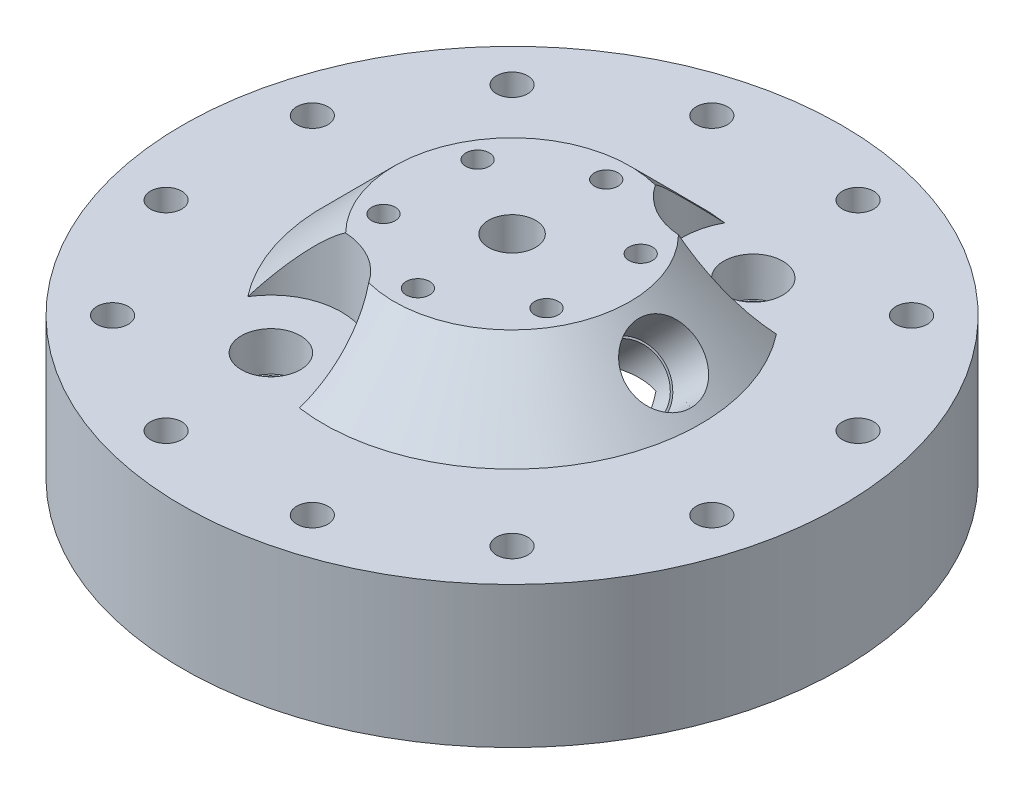
from build123d import *

# Parameters (mm, degrees)
F_5_16_CLEARANCE_HOLE1_D         = 8.4328
CIRPATTERN1_COUNT                = 12
F_1_2_0_5_DIAMETER_HOLE1_D       = 12.7
F_1_1_5_DIAMETER_HOLE1_D         = 38.1
F_1_1_5_DIAMETER_HOLE1_DEPTH     = 19.05
CIRPATTERN2_COUNT                = 6
CIRPATTERN3_COUNT                = 2
F_1_8_0_125_DIAMETER_HOLE1_D     = 3.175
F_1_8_0_125_DIAMETER_HOLE1_DEPTH = 6.35
F_1_8_0_125_DIAMETER_HOLE1_TIP   = 0.953866233


with BuildPart() as part:
    # Sketch1 → Revolve1 (revolve)
    with BuildSketch(Plane.XY, mode=Mode.PRIVATE) as revolve1_sk:
        Polygon((-55.9435, 0), (-88.9, 0), (-88.9, 38.1), (-50.8, 38.1), (-31.75, 57.15), (0, 57.15), (0, 31.75), (-31.75, 31.75), (-31.75, 19.05), (-50.8, 19.05), (-50.8, 0), (-52.3875, 0), (-52.3875, 2.54), (-55.9435, 2.54), align=None)
    revolve(revolve1_sk.sketch.rotate(Axis((0, 0, 0), (0, 1, 0)), 270), axis=Axis((0, 0, 0), (0, 1, 0)))

    # 5/16 Clearance Hole1 (through all)
    with Locations(Plane(origin=(0, 38.1, 0), x_dir=(1, 0, 0), z_dir=(0, 1, 0))):
        with Locations((-73.603547963, -19.722011237)):
            f_5_16_clearance_hole1 = Hole(F_5_16_CLEARANCE_HOLE1_D / 2)

    # CirPattern1: 5/16 Clearance Hole1 ×12 about axis
    cirpattern1_axis = Axis((0, 0, 0), (0, 1, 0))
    for i in range(1, CIRPATTERN1_COUNT):
        add(f_5_16_clearance_hole1.rotate(cirpattern1_axis, i * 360 / CIRPATTERN1_COUNT), mode=Mode.SUBTRACT)

    # 1/2 (0.5) Diameter Hole1 (through all)
    with Locations(Plane(origin=(0, 57.15, 0), x_dir=(1, 0, 0), z_dir=(0, 1, 0))):
        with Locations((0, 0)):
            Hole(F_1_2_0_5_DIAMETER_HOLE1_D / 2)

    # Sketch11 → 1/2 NPT Tapped Hole1 (revolve, cut)
    with BuildSketch(Plane(origin=(41.275, 47.625, 0), x_dir=(-0.707106781186546, 0.707106781186549, 0), z_dir=(0, 0, 1))):
        Polygon((0, 0), (0, 125.723585695), (8.9281, 125.723585695), (8.9281, 13.462), (9.479726792, 13.462), (9.8827971, 0), align=None)
    revolve(axis=Axis((45.765128061, 52.115128061, 0), (-0.707106781186549, -0.707106781186546, 0)), mode=Mode.SUBTRACT)

    # 1 (1.5) Diameter Hole1
    with Locations(Plane(origin=(0, 57.15, 0), x_dir=(1, 0, 0), z_dir=(0, 1, 0))):
        with Locations((-23.8125, -41.244459855)):
            f_1_1_5_diameter_hole1 = Hole(F_1_1_5_DIAMETER_HOLE1_D / 2, depth=F_1_1_5_DIAMETER_HOLE1_DEPTH)

    # Sketch19 → 3/8 NPT Tapped Hole1 (revolve, cut)
    with BuildSketch(Plane(origin=(-23.8125, 38.1, 41.244459855), x_dir=(0, 0, 1), z_dir=(1, 0, 0))):
        Polygon((0, 0), (0, 26.640582582), (7.1374, 22.352), (7.1374, 10.414), (7.653732494, 10.414), (7.9655416, 0), align=None)
    f_3_8_npt_tapped_hole1 = revolve(axis=Axis((-23.8125, 44.45, 41.244459855), (0, -1, 0)), mode=Mode.SUBTRACT)

    # Sketch21 → 1/4 (0.25) Diameter Hole1 (revolve, cut)
    with BuildSketch(Plane(origin=(21.997045256, 57.15, -12.7), x_dir=(0, 0, 1), z_dir=(1, 0, 0))):
        Polygon((0, 0), (0, 17.782732465), (3.175, 15.875), (3.175, 0), align=None)
    f_1_4_0_25_diameter_hole1 = revolve(axis=Axis((21.997045256, 63.5, -12.7), (0, -1, 0)), mode=Mode.SUBTRACT)

    # CirPattern2: 1/4 (0.25) Diameter Hole1 ×6 about axis
    cirpattern2_axis = Axis((0, 0, 0), (0, 1, 0))
    for i in range(1, CIRPATTERN2_COUNT):
        add(f_1_4_0_25_diameter_hole1.rotate(cirpattern2_axis, i * 360 / CIRPATTERN2_COUNT), mode=Mode.SUBTRACT)

    # CirPattern3: 1 (1.5) Diameter Hole1, 3/8 NPT Tapped Hole1 ×2 about axis
    cirpattern3_axis = Axis((0, 0, 0), (0, 1, 0))
    add([f_1_1_5_diameter_hole1.rotate(cirpattern3_axis, i * 360 / CIRPATTERN3_COUNT) for i in range(1, CIRPATTERN3_COUNT)], mode=Mode.SUBTRACT)
    add([f_3_8_npt_tapped_hole1.rotate(cirpattern3_axis, i * 360 / CIRPATTERN3_COUNT) for i in range(1, CIRPATTERN3_COUNT)], mode=Mode.SUBTRACT)

    # 1/8 (0.125) Diameter Hole1
    with Locations(Plane(origin=(0, 19.05, 0), x_dir=(-1, 0, 0), z_dir=(0, -1, 0))):
        with Locations((0, 44.45)):
            Hole(F_1_8_0_125_DIAMETER_HOLE1_D / 2, depth=F_1_8_0_125_DIAMETER_HOLE1_DEPTH)
            with Locations((0, 0, -(F_1_8_0_125_DIAMETER_HOLE1_DEPTH + F_1_8_0_125_DIAMETER_HOLE1_TIP / 2))):  # 118° drill point
                Cone(0, F_1_8_0_125_DIAMETER_HOLE1_D / 2, F_1_8_0_125_DIAMETER_HOLE1_TIP, mode=Mode.SUBTRACT)


solid = part.part
